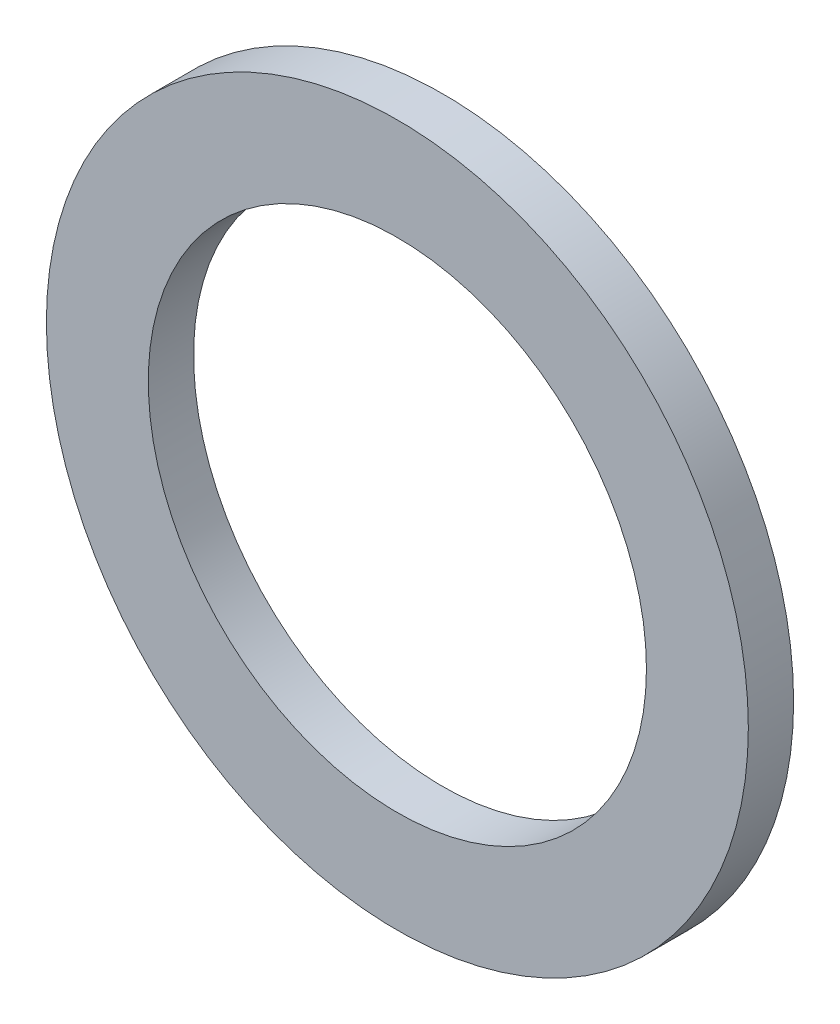
from build123d import *

# Parameters (mm, degrees)
SKETCH1_R      = 24.60625
SKETCH1_R_2    = 17.4625
EXTRUDE1_DEPTH = 1.5875


with BuildPart() as part:
    # Sketch1 → Extrude1 (new, symmetric)
    with BuildSketch(Plane.XY):
        Circle(SKETCH1_R)
        Circle(SKETCH1_R_2, mode=Mode.SUBTRACT)
    extrude(amount=EXTRUDE1_DEPTH, both=True)


solid = part.part
